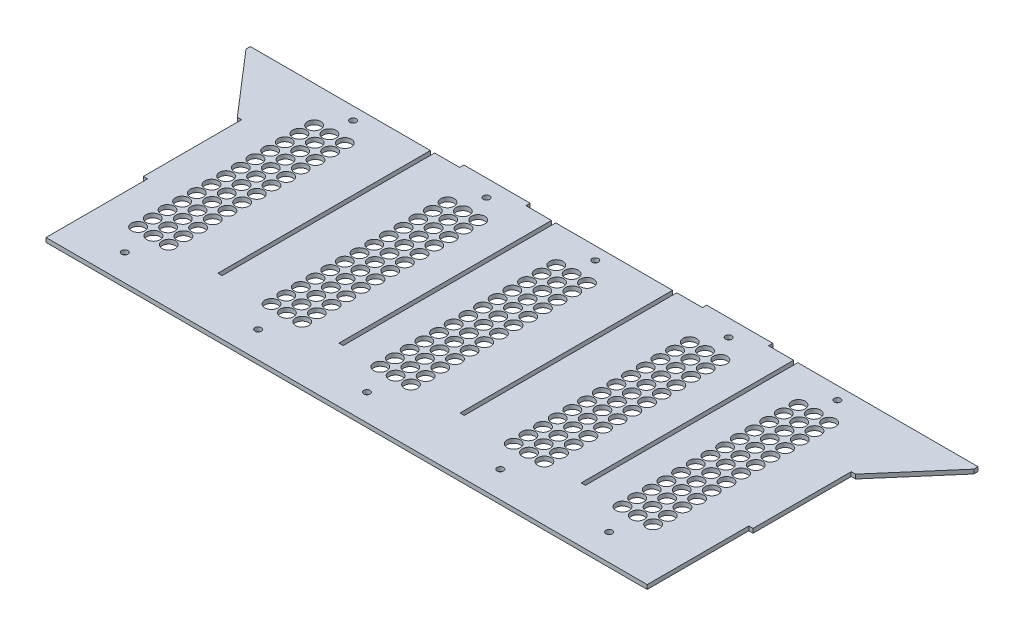
from build123d import *

# Parameters (mm, degrees)
SKETCH1_W                  = 457.2230066
SKETCH1_H                  = 3.175
BOSS_EXTRUDE1_DEPTH        = 200.6419914
BOSS_EXTRUDE3_DEPTH        = 3.175
SKETCH5_W                  = 3.175
SKETCH5_H                  = 76.2
CUT_EXTRUDE2_DEPTH         = 3.175
SKETCH3_W                  = 49.658811606
SKETCH3_H                  = 3.175
BOSS_EXTRUDE4_DEPTH        = 3.18
M4_CLEARANCE_HOLE1_D       = 4.8
LPATTERN5_COUNT            = 3
LPATTERN5_PITCH            = 181.61399999
M4_CLEARANCE_HOLE2_D       = 4.8
LPATTERN6_COUNT            = 2
LPATTERN6_PITCH            = 181.61399999
SKETCH10_R                 = 5
CUT_EXTRUDE3_DEPTH         = 339.72456808
LPATTERN1_COUNT            = 13
LPATTERN1_PITCH            = 11
LPATTERN2_COUNT            = 3
LPATTERN2_PITCH            = 181.61399999
LPATTERN2_COPY_1_SKETCH_R  = 5
LPATTERN2_COPY_1_DEPTH     = 339.72456808
LPATTERN2_COPY_2_SKETCH_R  = 5
LPATTERN2_COPY_2_DEPTH     = 339.72456808
LPATTERN2_COPY_3_SKETCH_R  = 5
LPATTERN2_COPY_3_DEPTH     = 339.72456808
LPATTERN2_COPY_4_SKETCH_R  = 5
LPATTERN2_COPY_4_DEPTH     = 339.72456808
LPATTERN2_COPY_5_SKETCH_R  = 5
LPATTERN2_COPY_5_DEPTH     = 339.72456808
LPATTERN2_COPY_6_SKETCH_R  = 5
LPATTERN2_COPY_6_DEPTH     = 339.72456808
LPATTERN2_COPY_7_SKETCH_R  = 5
LPATTERN2_COPY_7_DEPTH     = 339.72456808
LPATTERN2_COPY_8_SKETCH_R  = 5
LPATTERN2_COPY_8_DEPTH     = 339.72456808
LPATTERN2_COPY_9_SKETCH_R  = 5
LPATTERN2_COPY_9_DEPTH     = 339.72456808
LPATTERN2_COPY_10_SKETCH_R = 5
LPATTERN2_COPY_10_DEPTH    = 339.72456808
LPATTERN2_COPY_11_SKETCH_R = 5
LPATTERN2_COPY_11_DEPTH    = 339.72456808
LPATTERN2_COPY_12_SKETCH_R = 5
LPATTERN2_COPY_12_DEPTH    = 339.72456808
LPATTERN2_COPY_13_SKETCH_R = 5
LPATTERN2_COPY_13_DEPTH    = 339.72456808
LPATTERN2_COPY_14_SKETCH_R = 5
LPATTERN2_COPY_14_DEPTH    = 339.72456808
LPATTERN2_COPY_15_SKETCH_R = 5
LPATTERN2_COPY_15_DEPTH    = 339.72456808
LPATTERN2_COPY_16_SKETCH_R = 5
LPATTERN2_COPY_16_DEPTH    = 339.72456808
LPATTERN2_COPY_17_SKETCH_R = 5
LPATTERN2_COPY_17_DEPTH    = 339.72456808
LPATTERN2_COPY_18_SKETCH_R = 5
LPATTERN2_COPY_18_DEPTH    = 339.72456808
LPATTERN2_COPY_19_SKETCH_R = 5
LPATTERN2_COPY_19_DEPTH    = 339.72456808
LPATTERN2_COPY_20_SKETCH_R = 5
LPATTERN2_COPY_20_DEPTH    = 339.72456808
LPATTERN2_COPY_21_SKETCH_R = 5
LPATTERN2_COPY_21_DEPTH    = 339.72456808
LPATTERN2_COPY_22_SKETCH_R = 5
LPATTERN2_COPY_22_DEPTH    = 339.72456808
LPATTERN2_COPY_23_SKETCH_R = 5
LPATTERN2_COPY_23_DEPTH    = 339.72456808
LPATTERN2_COPY_24_SKETCH_R = 5
LPATTERN2_COPY_24_DEPTH    = 339.72456808
SKETCH11_R                 = 5
CUT_EXTRUDE4_DEPTH         = 339.72456808
LPATTERN3_COUNT            = 13
LPATTERN3_PITCH            = 11
LPATTERN4_COUNT            = 2
LPATTERN4_PITCH            = 181.61399999
LPATTERN4_COPY_1_SKETCH_R  = 5
LPATTERN4_COPY_1_DEPTH     = 339.72456808
LPATTERN4_COPY_2_SKETCH_R  = 5
LPATTERN4_COPY_2_DEPTH     = 339.72456808
LPATTERN4_COPY_3_SKETCH_R  = 5
LPATTERN4_COPY_3_DEPTH     = 339.72456808
LPATTERN4_COPY_4_SKETCH_R  = 5
LPATTERN4_COPY_4_DEPTH     = 339.72456808
LPATTERN4_COPY_5_SKETCH_R  = 5
LPATTERN4_COPY_5_DEPTH     = 339.72456808
LPATTERN4_COPY_6_SKETCH_R  = 5
LPATTERN4_COPY_6_DEPTH     = 339.72456808
LPATTERN4_COPY_7_SKETCH_R  = 5
LPATTERN4_COPY_7_DEPTH     = 339.72456808
LPATTERN4_COPY_8_SKETCH_R  = 5
LPATTERN4_COPY_8_DEPTH     = 339.72456808
LPATTERN4_COPY_9_SKETCH_R  = 5
LPATTERN4_COPY_9_DEPTH     = 339.72456808
LPATTERN4_COPY_10_SKETCH_R = 5
LPATTERN4_COPY_10_DEPTH    = 339.72456808
LPATTERN4_COPY_11_SKETCH_R = 5
LPATTERN4_COPY_11_DEPTH    = 339.72456808
LPATTERN4_COPY_12_SKETCH_R = 5
LPATTERN4_COPY_12_DEPTH    = 339.72456808
SKETCH12_W                 = 3.175
SKETCH12_H                 = 159.38680012
CUT_EXTRUDE5_DEPTH         = 339.72456808


with BuildPart() as part:
    # Sketch1 → Boss-Extrude1 (new body)
    with BuildSketch(Plane.XY):
        Rectangle(SKETCH1_W, SKETCH1_H)
    extrude(amount=BOSS_EXTRUDE1_DEPTH)

    # Sketch4 → Boss-Extrude3 (add)
    with BuildSketch(Plane.XZ.offset(1.5875)):
        Polygon((-228.6115033, 0), (-272.8865033, 0), (-272.8865033, 3.175), (-231.7865033, 50.8), (-228.6115033, 50.8), align=None)
    boss_extrude3 = extrude(amount=-BOSS_EXTRUDE3_DEPTH)

    # Mirror1: Boss-Extrude3 across plane
    add(boss_extrude3.mirror(Plane(origin=(0, 0, 0), x_dir=(0, 0, 1), z_dir=(1, 0, 0))))

    # Sketch5 → Cut-Extrude2 (cut)
    with BuildSketch(Plane.XZ.offset(1.5875)):
        with Locations((-227.0240033, 162.5419914)):
            Rectangle(SKETCH5_W, SKETCH5_H)
    cut_extrude2 = extrude(amount=-CUT_EXTRUDE2_DEPTH, mode=Mode.SUBTRACT)

    # Mirror2: Cut-Extrude2 across plane
    add(cut_extrude2.mirror(Plane(origin=(0, 0, 0), x_dir=(0, 0, 1), z_dir=(1, 0, 0))), mode=Mode.SUBTRACT)

    # Sketch3 → Boss-Extrude4 (add)
    with BuildSketch(Plane(origin=(0, 0, 0), x_dir=(-1, 0, 0), z_dir=(0, 0, -1))):
        with Locations((-91.020094169, 0)):
            Rectangle(SKETCH3_W, SKETCH3_H)
        with Locations((91.020094169, 0)):
            Rectangle(SKETCH3_W, SKETCH3_H)
    extrude(amount=BOSS_EXTRUDE4_DEPTH)

    # M4 Clearance Hole1 (through all)
    with Locations(Plane.XZ.offset(1.5875)):
        with Locations((-186.235499988, 9.525), (-186.235499988, 180.775)):
            m4_clearance_hole1 = Hole(M4_CLEARANCE_HOLE1_D / 2)

    # LPattern5: M4 Clearance Hole1 ×3
    with Locations(*[(i * LPATTERN5_PITCH, 0, 0) for i in range(1, LPATTERN5_COUNT)]):
        add(m4_clearance_hole1, mode=Mode.SUBTRACT)

    # M4 Clearance Hole2 (through all)
    with Locations(Plane.XZ.offset(1.5875)):
        with Locations((-86.190499988, 9.525), (-86.190499988, 180.775)):
            m4_clearance_hole2 = Hole(M4_CLEARANCE_HOLE2_D / 2)

    # LPattern6: M4 Clearance Hole2 ×2
    with Locations(*[(i * LPATTERN6_PITCH, 0, 0) for i in range(1, LPATTERN6_COUNT)]):
        add(m4_clearance_hole2, mode=Mode.SUBTRACT)

    # Sketch10 → Cut-Extrude3 (cut, through all)
    with BuildSketch(Plane.XZ.offset(1.5875)):
        with Locations(Location((-197.735499988, 159.256662939, 0), (0, 0, 270))):
            Circle(SKETCH10_R)
        with Locations(Location((-186.235499988, 159.256662939, 0), (0, 0, 270))):
            Circle(SKETCH10_R)
        with Locations(Location((-174.735499988, 159.256662939, 0), (0, 0, 270))):
            Circle(SKETCH10_R)
    cut_extrude3 = extrude(amount=-CUT_EXTRUDE3_DEPTH, mode=Mode.SUBTRACT)

    # LPattern1: Cut-Extrude3 ×13
    with Locations(*[(0, 0, -i * LPATTERN1_PITCH) for i in range(1, LPATTERN1_COUNT)]):
        add(cut_extrude3, mode=Mode.SUBTRACT)

    # LPattern2: Cut-Extrude3 ×3
    with Locations(*[(i * LPATTERN2_PITCH, 0, 0) for i in range(1, LPATTERN2_COUNT)]):
        add(cut_extrude3, mode=Mode.SUBTRACT)

    # LPattern2 copy 1 sketch → LPattern2 copy 1 (cut, through all)
    with BuildSketch(Plane(origin=(181.61399999, -1.5875, -11), x_dir=(1, 0, 0), z_dir=(0, -1, 0))):
        with Locations(Location((-197.735499988, 159.256662939, 0), (0, 0, 270))):
            Circle(LPATTERN2_COPY_1_SKETCH_R)
        with Locations(Location((-186.235499988, 159.256662939, 0), (0, 0, 270))):
            Circle(LPATTERN2_COPY_1_SKETCH_R)
        with Locations(Location((-174.735499988, 159.256662939, 0), (0, 0, 270))):
            Circle(LPATTERN2_COPY_1_SKETCH_R)
    extrude(amount=-LPATTERN2_COPY_1_DEPTH, mode=Mode.SUBTRACT)

    # LPattern2 copy 2 sketch → LPattern2 copy 2 (cut, through all)
    with BuildSketch(Plane(origin=(363.22799998, -1.5875, -11), x_dir=(1, 0, 0), z_dir=(0, -1, 0))):
        with Locations(Location((-197.735499988, 159.256662939, 0), (0, 0, 270))):
            Circle(LPATTERN2_COPY_2_SKETCH_R)
        with Locations(Location((-186.235499988, 159.256662939, 0), (0, 0, 270))):
            Circle(LPATTERN2_COPY_2_SKETCH_R)
        with Locations(Location((-174.735499988, 159.256662939, 0), (0, 0, 270))):
            Circle(LPATTERN2_COPY_2_SKETCH_R)
    extrude(amount=-LPATTERN2_COPY_2_DEPTH, mode=Mode.SUBTRACT)

    # LPattern2 copy 3 sketch → LPattern2 copy 3 (cut, through all)
    with BuildSketch(Plane(origin=(181.61399999, -1.5875, -22), x_dir=(1, 0, 0), z_dir=(0, -1, 0))):
        with Locations(Location((-197.735499988, 159.256662939, 0), (0, 0, 270))):
            Circle(LPATTERN2_COPY_3_SKETCH_R)
        with Locations(Location((-186.235499988, 159.256662939, 0), (0, 0, 270))):
            Circle(LPATTERN2_COPY_3_SKETCH_R)
        with Locations(Location((-174.735499988, 159.256662939, 0), (0, 0, 270))):
            Circle(LPATTERN2_COPY_3_SKETCH_R)
    extrude(amount=-LPATTERN2_COPY_3_DEPTH, mode=Mode.SUBTRACT)

    # LPattern2 copy 4 sketch → LPattern2 copy 4 (cut, through all)
    with BuildSketch(Plane(origin=(363.22799998, -1.5875, -22), x_dir=(1, 0, 0), z_dir=(0, -1, 0))):
        with Locations(Location((-197.735499988, 159.256662939, 0), (0, 0, 270))):
            Circle(LPATTERN2_COPY_4_SKETCH_R)
        with Locations(Location((-186.235499988, 159.256662939, 0), (0, 0, 270))):
            Circle(LPATTERN2_COPY_4_SKETCH_R)
        with Locations(Location((-174.735499988, 159.256662939, 0), (0, 0, 270))):
            Circle(LPATTERN2_COPY_4_SKETCH_R)
    extrude(amount=-LPATTERN2_COPY_4_DEPTH, mode=Mode.SUBTRACT)

    # LPattern2 copy 5 sketch → LPattern2 copy 5 (cut, through all)
    with BuildSketch(Plane(origin=(181.61399999, -1.5875, -33), x_dir=(1, 0, 0), z_dir=(0, -1, 0))):
        with Locations(Location((-197.735499988, 159.256662939, 0), (0, 0, 270))):
            Circle(LPATTERN2_COPY_5_SKETCH_R)
        with Locations(Location((-186.235499988, 159.256662939, 0), (0, 0, 270))):
            Circle(LPATTERN2_COPY_5_SKETCH_R)
        with Locations(Location((-174.735499988, 159.256662939, 0), (0, 0, 270))):
            Circle(LPATTERN2_COPY_5_SKETCH_R)
    extrude(amount=-LPATTERN2_COPY_5_DEPTH, mode=Mode.SUBTRACT)

    # LPattern2 copy 6 sketch → LPattern2 copy 6 (cut, through all)
    with BuildSketch(Plane(origin=(363.22799998, -1.5875, -33), x_dir=(1, 0, 0), z_dir=(0, -1, 0))):
        with Locations(Location((-197.735499988, 159.256662939, 0), (0, 0, 270))):
            Circle(LPATTERN2_COPY_6_SKETCH_R)
        with Locations(Location((-186.235499988, 159.256662939, 0), (0, 0, 270))):
            Circle(LPATTERN2_COPY_6_SKETCH_R)
        with Locations(Location((-174.735499988, 159.256662939, 0), (0, 0, 270))):
            Circle(LPATTERN2_COPY_6_SKETCH_R)
    extrude(amount=-LPATTERN2_COPY_6_DEPTH, mode=Mode.SUBTRACT)

    # LPattern2 copy 7 sketch → LPattern2 copy 7 (cut, through all)
    with BuildSketch(Plane(origin=(181.61399999, -1.5875, -44), x_dir=(1, 0, 0), z_dir=(0, -1, 0))):
        with Locations(Location((-197.735499988, 159.256662939, 0), (0, 0, 270))):
            Circle(LPATTERN2_COPY_7_SKETCH_R)
        with Locations(Location((-186.235499988, 159.256662939, 0), (0, 0, 270))):
            Circle(LPATTERN2_COPY_7_SKETCH_R)
        with Locations(Location((-174.735499988, 159.256662939, 0), (0, 0, 270))):
            Circle(LPATTERN2_COPY_7_SKETCH_R)
    extrude(amount=-LPATTERN2_COPY_7_DEPTH, mode=Mode.SUBTRACT)

    # LPattern2 copy 8 sketch → LPattern2 copy 8 (cut, through all)
    with BuildSketch(Plane(origin=(363.22799998, -1.5875, -44), x_dir=(1, 0, 0), z_dir=(0, -1, 0))):
        with Locations(Location((-197.735499988, 159.256662939, 0), (0, 0, 270))):
            Circle(LPATTERN2_COPY_8_SKETCH_R)
        with Locations(Location((-186.235499988, 159.256662939, 0), (0, 0, 270))):
            Circle(LPATTERN2_COPY_8_SKETCH_R)
        with Locations(Location((-174.735499988, 159.256662939, 0), (0, 0, 270))):
            Circle(LPATTERN2_COPY_8_SKETCH_R)
    extrude(amount=-LPATTERN2_COPY_8_DEPTH, mode=Mode.SUBTRACT)

    # LPattern2 copy 9 sketch → LPattern2 copy 9 (cut, through all)
    with BuildSketch(Plane(origin=(181.61399999, -1.5875, -55), x_dir=(1, 0, 0), z_dir=(0, -1, 0))):
        with Locations(Location((-197.735499988, 159.256662939, 0), (0, 0, 270))):
            Circle(LPATTERN2_COPY_9_SKETCH_R)
        with Locations(Location((-186.235499988, 159.256662939, 0), (0, 0, 270))):
            Circle(LPATTERN2_COPY_9_SKETCH_R)
        with Locations(Location((-174.735499988, 159.256662939, 0), (0, 0, 270))):
            Circle(LPATTERN2_COPY_9_SKETCH_R)
    extrude(amount=-LPATTERN2_COPY_9_DEPTH, mode=Mode.SUBTRACT)

    # LPattern2 copy 10 sketch → LPattern2 copy 10 (cut, through all)
    with BuildSketch(Plane(origin=(363.22799998, -1.5875, -55), x_dir=(1, 0, 0), z_dir=(0, -1, 0))):
        with Locations(Location((-197.735499988, 159.256662939, 0), (0, 0, 270))):
            Circle(LPATTERN2_COPY_10_SKETCH_R)
        with Locations(Location((-186.235499988, 159.256662939, 0), (0, 0, 270))):
            Circle(LPATTERN2_COPY_10_SKETCH_R)
        with Locations(Location((-174.735499988, 159.256662939, 0), (0, 0, 270))):
            Circle(LPATTERN2_COPY_10_SKETCH_R)
    extrude(amount=-LPATTERN2_COPY_10_DEPTH, mode=Mode.SUBTRACT)

    # LPattern2 copy 11 sketch → LPattern2 copy 11 (cut, through all)
    with BuildSketch(Plane(origin=(181.61399999, -1.5875, -66), x_dir=(1, 0, 0), z_dir=(0, -1, 0))):
        with Locations(Location((-197.735499988, 159.256662939, 0), (0, 0, 270))):
            Circle(LPATTERN2_COPY_11_SKETCH_R)
        with Locations(Location((-186.235499988, 159.256662939, 0), (0, 0, 270))):
            Circle(LPATTERN2_COPY_11_SKETCH_R)
        with Locations(Location((-174.735499988, 159.256662939, 0), (0, 0, 270))):
            Circle(LPATTERN2_COPY_11_SKETCH_R)
    extrude(amount=-LPATTERN2_COPY_11_DEPTH, mode=Mode.SUBTRACT)

    # LPattern2 copy 12 sketch → LPattern2 copy 12 (cut, through all)
    with BuildSketch(Plane(origin=(363.22799998, -1.5875, -66), x_dir=(1, 0, 0), z_dir=(0, -1, 0))):
        with Locations(Location((-197.735499988, 159.256662939, 0), (0, 0, 270))):
            Circle(LPATTERN2_COPY_12_SKETCH_R)
        with Locations(Location((-186.235499988, 159.256662939, 0), (0, 0, 270))):
            Circle(LPATTERN2_COPY_12_SKETCH_R)
        with Locations(Location((-174.735499988, 159.256662939, 0), (0, 0, 270))):
            Circle(LPATTERN2_COPY_12_SKETCH_R)
    extrude(amount=-LPATTERN2_COPY_12_DEPTH, mode=Mode.SUBTRACT)

    # LPattern2 copy 13 sketch → LPattern2 copy 13 (cut, through all)
    with BuildSketch(Plane(origin=(181.61399999, -1.5875, -77), x_dir=(1, 0, 0), z_dir=(0, -1, 0))):
        with Locations(Location((-197.735499988, 159.256662939, 0), (0, 0, 270))):
            Circle(LPATTERN2_COPY_13_SKETCH_R)
        with Locations(Location((-186.235499988, 159.256662939, 0), (0, 0, 270))):
            Circle(LPATTERN2_COPY_13_SKETCH_R)
        with Locations(Location((-174.735499988, 159.256662939, 0), (0, 0, 270))):
            Circle(LPATTERN2_COPY_13_SKETCH_R)
    extrude(amount=-LPATTERN2_COPY_13_DEPTH, mode=Mode.SUBTRACT)

    # LPattern2 copy 14 sketch → LPattern2 copy 14 (cut, through all)
    with BuildSketch(Plane(origin=(363.22799998, -1.5875, -77), x_dir=(1, 0, 0), z_dir=(0, -1, 0))):
        with Locations(Location((-197.735499988, 159.256662939, 0), (0, 0, 270))):
            Circle(LPATTERN2_COPY_14_SKETCH_R)
        with Locations(Location((-186.235499988, 159.256662939, 0), (0, 0, 270))):
            Circle(LPATTERN2_COPY_14_SKETCH_R)
        with Locations(Location((-174.735499988, 159.256662939, 0), (0, 0, 270))):
            Circle(LPATTERN2_COPY_14_SKETCH_R)
    extrude(amount=-LPATTERN2_COPY_14_DEPTH, mode=Mode.SUBTRACT)

    # LPattern2 copy 15 sketch → LPattern2 copy 15 (cut, through all)
    with BuildSketch(Plane(origin=(181.61399999, -1.5875, -88), x_dir=(1, 0, 0), z_dir=(0, -1, 0))):
        with Locations(Location((-197.735499988, 159.256662939, 0), (0, 0, 270))):
            Circle(LPATTERN2_COPY_15_SKETCH_R)
        with Locations(Location((-186.235499988, 159.256662939, 0), (0, 0, 270))):
            Circle(LPATTERN2_COPY_15_SKETCH_R)
        with Locations(Location((-174.735499988, 159.256662939, 0), (0, 0, 270))):
            Circle(LPATTERN2_COPY_15_SKETCH_R)
    extrude(amount=-LPATTERN2_COPY_15_DEPTH, mode=Mode.SUBTRACT)

    # LPattern2 copy 16 sketch → LPattern2 copy 16 (cut, through all)
    with BuildSketch(Plane(origin=(363.22799998, -1.5875, -88), x_dir=(1, 0, 0), z_dir=(0, -1, 0))):
        with Locations(Location((-197.735499988, 159.256662939, 0), (0, 0, 270))):
            Circle(LPATTERN2_COPY_16_SKETCH_R)
        with Locations(Location((-186.235499988, 159.256662939, 0), (0, 0, 270))):
            Circle(LPATTERN2_COPY_16_SKETCH_R)
        with Locations(Location((-174.735499988, 159.256662939, 0), (0, 0, 270))):
            Circle(LPATTERN2_COPY_16_SKETCH_R)
    extrude(amount=-LPATTERN2_COPY_16_DEPTH, mode=Mode.SUBTRACT)

    # LPattern2 copy 17 sketch → LPattern2 copy 17 (cut, through all)
    with BuildSketch(Plane(origin=(181.61399999, -1.5875, -99), x_dir=(1, 0, 0), z_dir=(0, -1, 0))):
        with Locations(Location((-197.735499988, 159.256662939, 0), (0, 0, 270))):
            Circle(LPATTERN2_COPY_17_SKETCH_R)
        with Locations(Location((-186.235499988, 159.256662939, 0), (0, 0, 270))):
            Circle(LPATTERN2_COPY_17_SKETCH_R)
        with Locations(Location((-174.735499988, 159.256662939, 0), (0, 0, 270))):
            Circle(LPATTERN2_COPY_17_SKETCH_R)
    extrude(amount=-LPATTERN2_COPY_17_DEPTH, mode=Mode.SUBTRACT)

    # LPattern2 copy 18 sketch → LPattern2 copy 18 (cut, through all)
    with BuildSketch(Plane(origin=(363.22799998, -1.5875, -99), x_dir=(1, 0, 0), z_dir=(0, -1, 0))):
        with Locations(Location((-197.735499988, 159.256662939, 0), (0, 0, 270))):
            Circle(LPATTERN2_COPY_18_SKETCH_R)
        with Locations(Location((-186.235499988, 159.256662939, 0), (0, 0, 270))):
            Circle(LPATTERN2_COPY_18_SKETCH_R)
        with Locations(Location((-174.735499988, 159.256662939, 0), (0, 0, 270))):
            Circle(LPATTERN2_COPY_18_SKETCH_R)
    extrude(amount=-LPATTERN2_COPY_18_DEPTH, mode=Mode.SUBTRACT)

    # LPattern2 copy 19 sketch → LPattern2 copy 19 (cut, through all)
    with BuildSketch(Plane(origin=(181.61399999, -1.5875, -110), x_dir=(1, 0, 0), z_dir=(0, -1, 0))):
        with Locations(Location((-197.735499988, 159.256662939, 0), (0, 0, 270))):
            Circle(LPATTERN2_COPY_19_SKETCH_R)
        with Locations(Location((-186.235499988, 159.256662939, 0), (0, 0, 270))):
            Circle(LPATTERN2_COPY_19_SKETCH_R)
        with Locations(Location((-174.735499988, 159.256662939, 0), (0, 0, 270))):
            Circle(LPATTERN2_COPY_19_SKETCH_R)
    extrude(amount=-LPATTERN2_COPY_19_DEPTH, mode=Mode.SUBTRACT)

    # LPattern2 copy 20 sketch → LPattern2 copy 20 (cut, through all)
    with BuildSketch(Plane(origin=(363.22799998, -1.5875, -110), x_dir=(1, 0, 0), z_dir=(0, -1, 0))):
        with Locations(Location((-197.735499988, 159.256662939, 0), (0, 0, 270))):
            Circle(LPATTERN2_COPY_20_SKETCH_R)
        with Locations(Location((-186.235499988, 159.256662939, 0), (0, 0, 270))):
            Circle(LPATTERN2_COPY_20_SKETCH_R)
        with Locations(Location((-174.735499988, 159.256662939, 0), (0, 0, 270))):
            Circle(LPATTERN2_COPY_20_SKETCH_R)
    extrude(amount=-LPATTERN2_COPY_20_DEPTH, mode=Mode.SUBTRACT)

    # LPattern2 copy 21 sketch → LPattern2 copy 21 (cut, through all)
    with BuildSketch(Plane(origin=(181.61399999, -1.5875, -121), x_dir=(1, 0, 0), z_dir=(0, -1, 0))):
        with Locations(Location((-197.735499988, 159.256662939, 0), (0, 0, 270))):
            Circle(LPATTERN2_COPY_21_SKETCH_R)
        with Locations(Location((-186.235499988, 159.256662939, 0), (0, 0, 270))):
            Circle(LPATTERN2_COPY_21_SKETCH_R)
        with Locations(Location((-174.735499988, 159.256662939, 0), (0, 0, 270))):
            Circle(LPATTERN2_COPY_21_SKETCH_R)
    extrude(amount=-LPATTERN2_COPY_21_DEPTH, mode=Mode.SUBTRACT)

    # LPattern2 copy 22 sketch → LPattern2 copy 22 (cut, through all)
    with BuildSketch(Plane(origin=(363.22799998, -1.5875, -121), x_dir=(1, 0, 0), z_dir=(0, -1, 0))):
        with Locations(Location((-197.735499988, 159.256662939, 0), (0, 0, 270))):
            Circle(LPATTERN2_COPY_22_SKETCH_R)
        with Locations(Location((-186.235499988, 159.256662939, 0), (0, 0, 270))):
            Circle(LPATTERN2_COPY_22_SKETCH_R)
        with Locations(Location((-174.735499988, 159.256662939, 0), (0, 0, 270))):
            Circle(LPATTERN2_COPY_22_SKETCH_R)
    extrude(amount=-LPATTERN2_COPY_22_DEPTH, mode=Mode.SUBTRACT)

    # LPattern2 copy 23 sketch → LPattern2 copy 23 (cut, through all)
    with BuildSketch(Plane(origin=(181.61399999, -1.5875, -132), x_dir=(1, 0, 0), z_dir=(0, -1, 0))):
        with Locations(Location((-197.735499988, 159.256662939, 0), (0, 0, 270))):
            Circle(LPATTERN2_COPY_23_SKETCH_R)
        with Locations(Location((-186.235499988, 159.256662939, 0), (0, 0, 270))):
            Circle(LPATTERN2_COPY_23_SKETCH_R)
        with Locations(Location((-174.735499988, 159.256662939, 0), (0, 0, 270))):
            Circle(LPATTERN2_COPY_23_SKETCH_R)
    extrude(amount=-LPATTERN2_COPY_23_DEPTH, mode=Mode.SUBTRACT)

    # LPattern2 copy 24 sketch → LPattern2 copy 24 (cut, through all)
    with BuildSketch(Plane(origin=(363.22799998, -1.5875, -132), x_dir=(1, 0, 0), z_dir=(0, -1, 0))):
        with Locations(Location((-197.735499988, 159.256662939, 0), (0, 0, 270))):
            Circle(LPATTERN2_COPY_24_SKETCH_R)
        with Locations(Location((-186.235499988, 159.256662939, 0), (0, 0, 270))):
            Circle(LPATTERN2_COPY_24_SKETCH_R)
        with Locations(Location((-174.735499988, 159.256662939, 0), (0, 0, 270))):
            Circle(LPATTERN2_COPY_24_SKETCH_R)
    extrude(amount=-LPATTERN2_COPY_24_DEPTH, mode=Mode.SUBTRACT)

    # Sketch11 → Cut-Extrude4 (cut, through all)
    with BuildSketch(Plane.XZ.offset(1.5875)):
        with Locations(Location((-97.690499988, 159.256662939, 0), (0, 0, 270))):
            Circle(SKETCH11_R)
        with Locations(Location((-86.190499988, 159.256662939, 0), (0, 0, 270))):
            Circle(SKETCH11_R)
        with Locations(Location((-74.690499988, 159.256662939, 0), (0, 0, 270))):
            Circle(SKETCH11_R)
    cut_extrude4 = extrude(amount=-CUT_EXTRUDE4_DEPTH, mode=Mode.SUBTRACT)

    # LPattern3: Cut-Extrude4 ×13
    with Locations(*[(0, 0, -i * LPATTERN3_PITCH) for i in range(1, LPATTERN3_COUNT)]):
        add(cut_extrude4, mode=Mode.SUBTRACT)

    # LPattern4: Cut-Extrude4 ×2
    with Locations(*[(i * LPATTERN4_PITCH, 0, 0) for i in range(1, LPATTERN4_COUNT)]):
        add(cut_extrude4, mode=Mode.SUBTRACT)

    # LPattern4 copy 1 sketch → LPattern4 copy 1 (cut, through all)
    with BuildSketch(Plane(origin=(181.61399999, -1.5875, -11), x_dir=(1, 0, 0), z_dir=(0, -1, 0))):
        with Locations(Location((-97.690499988, 159.256662939, 0), (0, 0, 270))):
            Circle(LPATTERN4_COPY_1_SKETCH_R)
        with Locations(Location((-86.190499988, 159.256662939, 0), (0, 0, 270))):
            Circle(LPATTERN4_COPY_1_SKETCH_R)
        with Locations(Location((-74.690499988, 159.256662939, 0), (0, 0, 270))):
            Circle(LPATTERN4_COPY_1_SKETCH_R)
    extrude(amount=-LPATTERN4_COPY_1_DEPTH, mode=Mode.SUBTRACT)

    # LPattern4 copy 2 sketch → LPattern4 copy 2 (cut, through all)
    with BuildSketch(Plane(origin=(181.61399999, -1.5875, -22), x_dir=(1, 0, 0), z_dir=(0, -1, 0))):
        with Locations(Location((-97.690499988, 159.256662939, 0), (0, 0, 270))):
            Circle(LPATTERN4_COPY_2_SKETCH_R)
        with Locations(Location((-86.190499988, 159.256662939, 0), (0, 0, 270))):
            Circle(LPATTERN4_COPY_2_SKETCH_R)
        with Locations(Location((-74.690499988, 159.256662939, 0), (0, 0, 270))):
            Circle(LPATTERN4_COPY_2_SKETCH_R)
    extrude(amount=-LPATTERN4_COPY_2_DEPTH, mode=Mode.SUBTRACT)

    # LPattern4 copy 3 sketch → LPattern4 copy 3 (cut, through all)
    with BuildSketch(Plane(origin=(181.61399999, -1.5875, -33), x_dir=(1, 0, 0), z_dir=(0, -1, 0))):
        with Locations(Location((-97.690499988, 159.256662939, 0), (0, 0, 270))):
            Circle(LPATTERN4_COPY_3_SKETCH_R)
        with Locations(Location((-86.190499988, 159.256662939, 0), (0, 0, 270))):
            Circle(LPATTERN4_COPY_3_SKETCH_R)
        with Locations(Location((-74.690499988, 159.256662939, 0), (0, 0, 270))):
            Circle(LPATTERN4_COPY_3_SKETCH_R)
    extrude(amount=-LPATTERN4_COPY_3_DEPTH, mode=Mode.SUBTRACT)

    # LPattern4 copy 4 sketch → LPattern4 copy 4 (cut, through all)
    with BuildSketch(Plane(origin=(181.61399999, -1.5875, -44), x_dir=(1, 0, 0), z_dir=(0, -1, 0))):
        with Locations(Location((-97.690499988, 159.256662939, 0), (0, 0, 270))):
            Circle(LPATTERN4_COPY_4_SKETCH_R)
        with Locations(Location((-86.190499988, 159.256662939, 0), (0, 0, 270))):
            Circle(LPATTERN4_COPY_4_SKETCH_R)
        with Locations(Location((-74.690499988, 159.256662939, 0), (0, 0, 270))):
            Circle(LPATTERN4_COPY_4_SKETCH_R)
    extrude(amount=-LPATTERN4_COPY_4_DEPTH, mode=Mode.SUBTRACT)

    # LPattern4 copy 5 sketch → LPattern4 copy 5 (cut, through all)
    with BuildSketch(Plane(origin=(181.61399999, -1.5875, -55), x_dir=(1, 0, 0), z_dir=(0, -1, 0))):
        with Locations(Location((-97.690499988, 159.256662939, 0), (0, 0, 270))):
            Circle(LPATTERN4_COPY_5_SKETCH_R)
        with Locations(Location((-86.190499988, 159.256662939, 0), (0, 0, 270))):
            Circle(LPATTERN4_COPY_5_SKETCH_R)
        with Locations(Location((-74.690499988, 159.256662939, 0), (0, 0, 270))):
            Circle(LPATTERN4_COPY_5_SKETCH_R)
    extrude(amount=-LPATTERN4_COPY_5_DEPTH, mode=Mode.SUBTRACT)

    # LPattern4 copy 6 sketch → LPattern4 copy 6 (cut, through all)
    with BuildSketch(Plane(origin=(181.61399999, -1.5875, -66), x_dir=(1, 0, 0), z_dir=(0, -1, 0))):
        with Locations(Location((-97.690499988, 159.256662939, 0), (0, 0, 270))):
            Circle(LPATTERN4_COPY_6_SKETCH_R)
        with Locations(Location((-86.190499988, 159.256662939, 0), (0, 0, 270))):
            Circle(LPATTERN4_COPY_6_SKETCH_R)
        with Locations(Location((-74.690499988, 159.256662939, 0), (0, 0, 270))):
            Circle(LPATTERN4_COPY_6_SKETCH_R)
    extrude(amount=-LPATTERN4_COPY_6_DEPTH, mode=Mode.SUBTRACT)

    # LPattern4 copy 7 sketch → LPattern4 copy 7 (cut, through all)
    with BuildSketch(Plane(origin=(181.61399999, -1.5875, -77), x_dir=(1, 0, 0), z_dir=(0, -1, 0))):
        with Locations(Location((-97.690499988, 159.256662939, 0), (0, 0, 270))):
            Circle(LPATTERN4_COPY_7_SKETCH_R)
        with Locations(Location((-86.190499988, 159.256662939, 0), (0, 0, 270))):
            Circle(LPATTERN4_COPY_7_SKETCH_R)
        with Locations(Location((-74.690499988, 159.256662939, 0), (0, 0, 270))):
            Circle(LPATTERN4_COPY_7_SKETCH_R)
    extrude(amount=-LPATTERN4_COPY_7_DEPTH, mode=Mode.SUBTRACT)

    # LPattern4 copy 8 sketch → LPattern4 copy 8 (cut, through all)
    with BuildSketch(Plane(origin=(181.61399999, -1.5875, -88), x_dir=(1, 0, 0), z_dir=(0, -1, 0))):
        with Locations(Location((-97.690499988, 159.256662939, 0), (0, 0, 270))):
            Circle(LPATTERN4_COPY_8_SKETCH_R)
        with Locations(Location((-86.190499988, 159.256662939, 0), (0, 0, 270))):
            Circle(LPATTERN4_COPY_8_SKETCH_R)
        with Locations(Location((-74.690499988, 159.256662939, 0), (0, 0, 270))):
            Circle(LPATTERN4_COPY_8_SKETCH_R)
    extrude(amount=-LPATTERN4_COPY_8_DEPTH, mode=Mode.SUBTRACT)

    # LPattern4 copy 9 sketch → LPattern4 copy 9 (cut, through all)
    with BuildSketch(Plane(origin=(181.61399999, -1.5875, -99), x_dir=(1, 0, 0), z_dir=(0, -1, 0))):
        with Locations(Location((-97.690499988, 159.256662939, 0), (0, 0, 270))):
            Circle(LPATTERN4_COPY_9_SKETCH_R)
        with Locations(Location((-86.190499988, 159.256662939, 0), (0, 0, 270))):
            Circle(LPATTERN4_COPY_9_SKETCH_R)
        with Locations(Location((-74.690499988, 159.256662939, 0), (0, 0, 270))):
            Circle(LPATTERN4_COPY_9_SKETCH_R)
    extrude(amount=-LPATTERN4_COPY_9_DEPTH, mode=Mode.SUBTRACT)

    # LPattern4 copy 10 sketch → LPattern4 copy 10 (cut, through all)
    with BuildSketch(Plane(origin=(181.61399999, -1.5875, -110), x_dir=(1, 0, 0), z_dir=(0, -1, 0))):
        with Locations(Location((-97.690499988, 159.256662939, 0), (0, 0, 270))):
            Circle(LPATTERN4_COPY_10_SKETCH_R)
        with Locations(Location((-86.190499988, 159.256662939, 0), (0, 0, 270))):
            Circle(LPATTERN4_COPY_10_SKETCH_R)
        with Locations(Location((-74.690499988, 159.256662939, 0), (0, 0, 270))):
            Circle(LPATTERN4_COPY_10_SKETCH_R)
    extrude(amount=-LPATTERN4_COPY_10_DEPTH, mode=Mode.SUBTRACT)

    # LPattern4 copy 11 sketch → LPattern4 copy 11 (cut, through all)
    with BuildSketch(Plane(origin=(181.61399999, -1.5875, -121), x_dir=(1, 0, 0), z_dir=(0, -1, 0))):
        with Locations(Location((-97.690499988, 159.256662939, 0), (0, 0, 270))):
            Circle(LPATTERN4_COPY_11_SKETCH_R)
        with Locations(Location((-86.190499988, 159.256662939, 0), (0, 0, 270))):
            Circle(LPATTERN4_COPY_11_SKETCH_R)
        with Locations(Location((-74.690499988, 159.256662939, 0), (0, 0, 270))):
            Circle(LPATTERN4_COPY_11_SKETCH_R)
    extrude(amount=-LPATTERN4_COPY_11_DEPTH, mode=Mode.SUBTRACT)

    # LPattern4 copy 12 sketch → LPattern4 copy 12 (cut, through all)
    with BuildSketch(Plane(origin=(181.61399999, -1.5875, -132), x_dir=(1, 0, 0), z_dir=(0, -1, 0))):
        with Locations(Location((-97.690499988, 159.256662939, 0), (0, 0, 270))):
            Circle(LPATTERN4_COPY_12_SKETCH_R)
        with Locations(Location((-86.190499988, 159.256662939, 0), (0, 0, 270))):
            Circle(LPATTERN4_COPY_12_SKETCH_R)
        with Locations(Location((-74.690499988, 159.256662939, 0), (0, 0, 270))):
            Circle(LPATTERN4_COPY_12_SKETCH_R)
    extrude(amount=-LPATTERN4_COPY_12_DEPTH, mode=Mode.SUBTRACT)

    # Sketch12 → Cut-Extrude5 (cut, through all)
    with BuildSketch(Plane.XZ.offset(1.5875)):
        with Locations((-136.212999988, 79.69340006)):
            Rectangle(SKETCH12_W, SKETCH12_H)
        with Locations((-45.405999988, 79.69340006)):
            Rectangle(SKETCH12_W, SKETCH12_H)
        with Locations((45.401000012, 79.69340006)):
            Rectangle(SKETCH12_W, SKETCH12_H)
        with Locations((136.208000012, 79.69340006)):
            Rectangle(SKETCH12_W, SKETCH12_H)
    extrude(amount=-CUT_EXTRUDE5_DEPTH, mode=Mode.SUBTRACT)


solid = part.part
